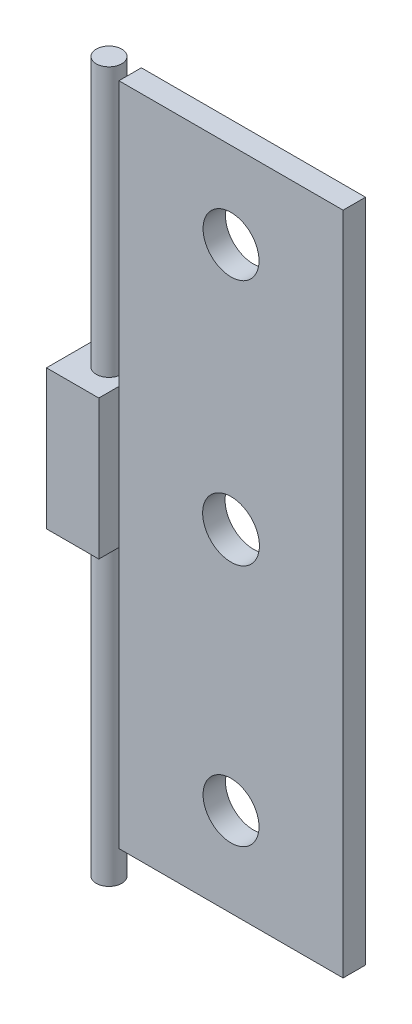
from build123d import *

# Parameters (mm, degrees)
CROQUIS1_W                   = 30
CROQUIS1_H                   = 89
SALIENTE_EXTRUIR1_DEPTH      = 3
CROQUIS2_R                   = 3.800850318
CROQUIS2_R_2                 = 3.742975761
CORTAR_EXTRUIR1_DEPTH        = 3
CROQUIS3_W                   = 7.223510215
CROQUIS3_H                   = 18.667669577
SALIENTE_EXTRUIR2_DEPTH      = 7
SALIENTE_EXTRUIR3_DEPTH      = 36
SALIENTE_EXTRUIR3_DEPTH_BACK = 59
CROQUIS4_R                   = 1.707521399


with BuildPart() as part:
    # Croquis1 → Saliente-Extruir1 (new body)
    with BuildSketch(Plane.XY):
        Rectangle(CROQUIS1_W, CROQUIS1_H)
    extrude(amount=SALIENTE_EXTRUIR1_DEPTH)

    # Croquis2 → Cortar-Extruir1 (cut)
    with BuildSketch(Plane.XY.offset(3)):
        Circle(CROQUIS2_R)
        with Locations((0, 32.997286313)):
            Circle(CROQUIS2_R_2)
        with Locations((0, -32.603288865)):
            Circle(CROQUIS2_R_2)
    extrude(amount=-CORTAR_EXTRUIR1_DEPTH, mode=Mode.SUBTRACT)

    # Croquis3 → Saliente-Extruir2 (add)
    with BuildSketch(Plane.ZY.offset(15)):
        with Locations((2.087224579, -0.259009368)):
            Rectangle(CROQUIS3_W, CROQUIS3_H)
    extrude(amount=SALIENTE_EXTRUIR2_DEPTH)

    # Croquis4 → Saliente-Extruir3 (add, two sides: drawn at the far end of the back side and taken through both)
    with BuildSketch(Plane(origin=(0, 9.074825421, 0), x_dir=(1, 0, 0), z_dir=(0, 1, 0)).offset(-SALIENTE_EXTRUIR3_DEPTH_BACK)):
        with Locations(Location((-17.910478142, -1.422079338, 0), (0, 0, 180))):
            Circle(CROQUIS4_R)
    extrude(amount=SALIENTE_EXTRUIR3_DEPTH + SALIENTE_EXTRUIR3_DEPTH_BACK)


solid = part.part
